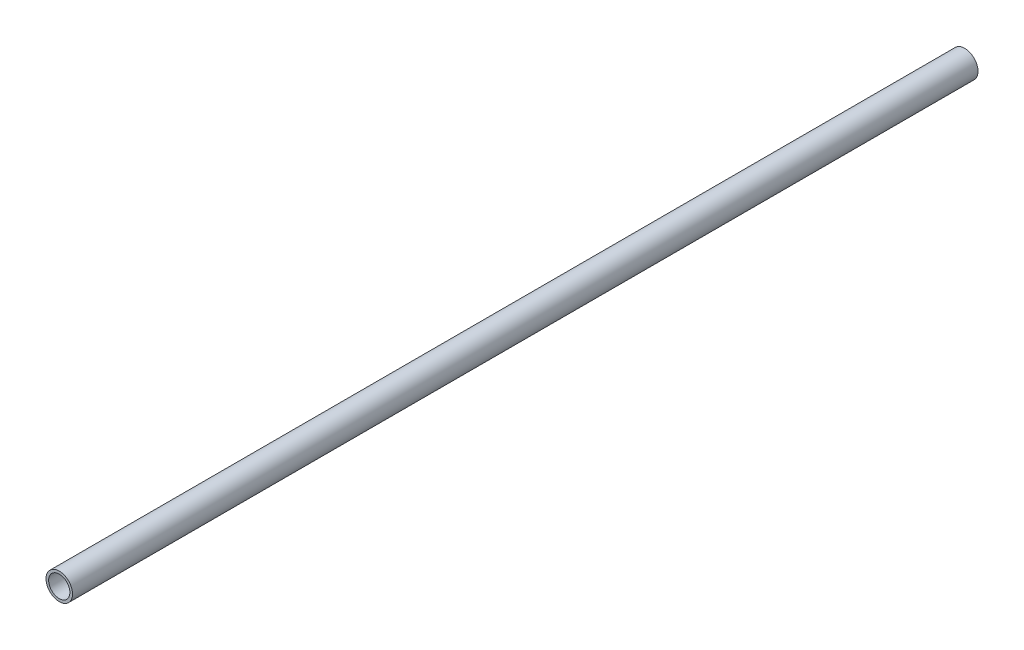
from build123d import *

# Parameters (mm, degrees)
SKETCH3_R           = 7.9375
SKETCH3_R_2         = 6.35
BOSS_EXTRUDE2_DEPTH = 542.027436889


with BuildPart() as part:
    # Sketch3 → Boss-Extrude2 (new body)
    with BuildSketch(Plane(origin=(0, 0, 40.774511507), x_dir=(-1, 0, 0), z_dir=(0, 0, -1))):
        with Locations(Location((0, 0, 0), (0, 0, 270))):
            Circle(SKETCH3_R)
        with Locations(Location((0, 0, 0), (0, 0, 270))):
            Circle(SKETCH3_R_2, mode=Mode.SUBTRACT)
    extrude(amount=BOSS_EXTRUDE2_DEPTH)


solid = part.part
